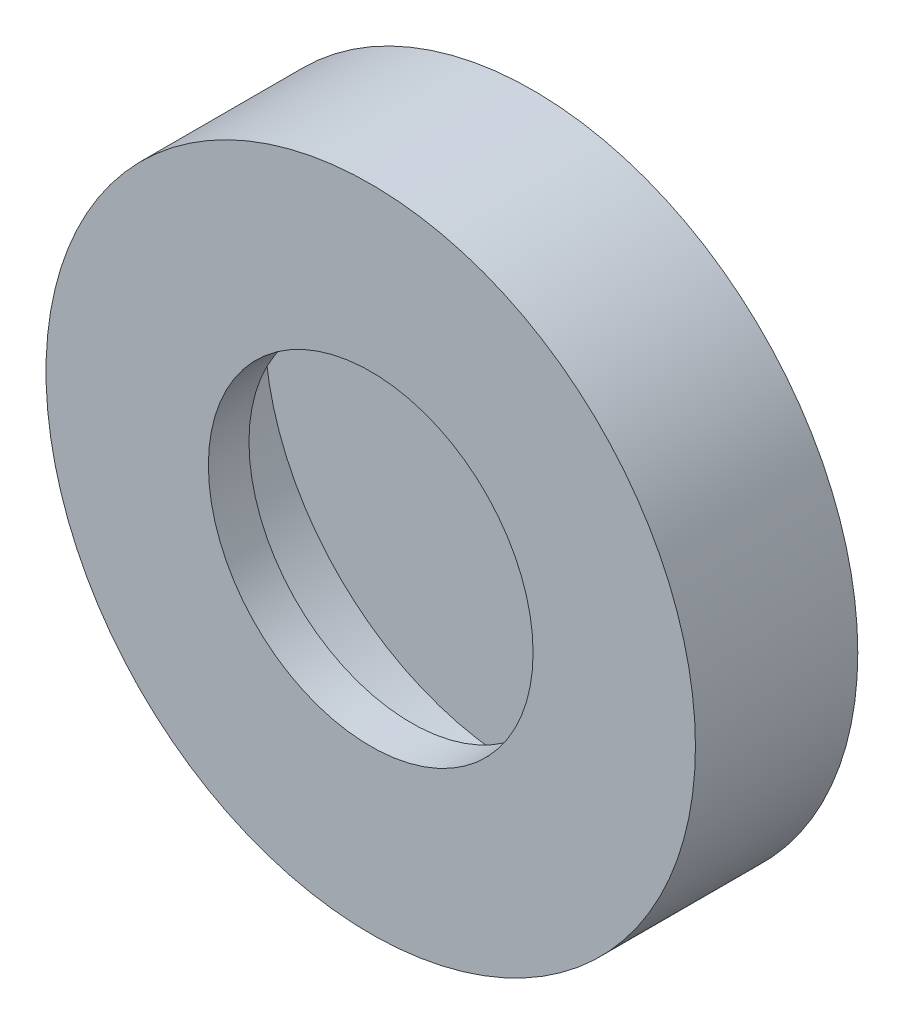
from build123d import *

# Parameters (mm, degrees)
ESQUISSE1_R             = 50.8
BOSS_EXTRU_2_DEPTH      = 25.4
ESQUISSE4_R             = 25.4
ENL_V_MAT_EXTRU_2_DEPTH = 6.35
ESQUISSE5_R             = 40
ENL_V_MAT_EXTRU_3_DEPTH = 17.05


with BuildPart() as part:
    # Esquisse1 → Boss.-Extru.2 (new body)
    with BuildSketch(Plane.XY):
        Circle(ESQUISSE1_R)
    extrude(amount=BOSS_EXTRU_2_DEPTH)

    # Esquisse4 → Enlèv. mat.-Extru.2 (cut)
    with BuildSketch(Plane.XY.offset(25.4)):
        Circle(ESQUISSE4_R)
    extrude(amount=-ENL_V_MAT_EXTRU_2_DEPTH, mode=Mode.SUBTRACT)

    # Esquisse5 → Enlèv. mat.-Extru.3 (cut)
    with BuildSketch(Plane.XY.offset(19.05)):
        Circle(ESQUISSE5_R)
    extrude(amount=-ENL_V_MAT_EXTRU_3_DEPTH, mode=Mode.SUBTRACT)


solid = part.part
